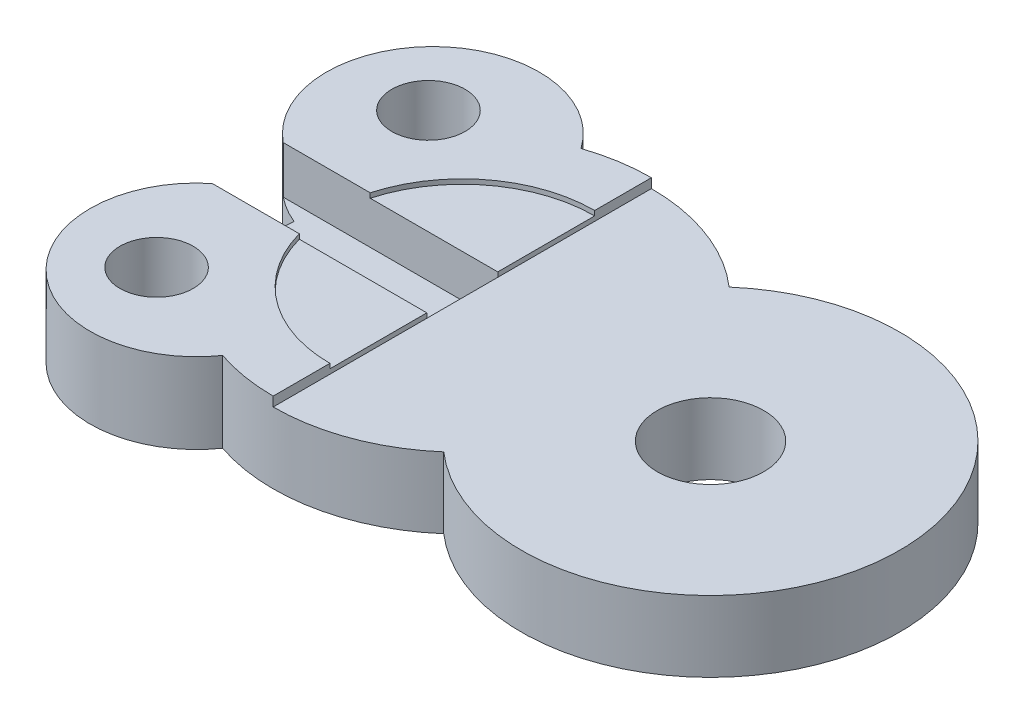
from build123d import *
from build123d.topology import SkipClean

# Parameters (mm, degrees)
SKETCH_1_R          = 2.25
EXTRUDE_1_DEPTH     = 3
EXTRUDE_2_DEPTH     = 0.4
SKETCH_6_W          = 12.522512513
SKETCH_6_H          = 3
CUT_EXTRUDE_1_DEPTH = 2
SKETCH_7_R          = 5.6
CUT_EXTRUDE_2_DEPTH = 0.2
SKETCH_9_R          = 1.55
CUT_EXTRUDE_3_DEPTH = 24.519352456


with BuildPart() as part:
    # 草图1 → 凸台-拉伸1 (new body)
    with BuildSketch(Plane(origin=(0, 0, 0), x_dir=(1, 0, 0), z_dir=(0, 1, 0))):
        with BuildLine():
            ThreePointArc((-5.25, -6.036348234), (8, 0), (-5.25, 6.036348234))
            ThreePointArc((-5.25, 6.036348234), (-8.948430916, 7.848097437), (-13.058047675, 7.579999479))
            ThreePointArc((-13.058047675, 7.579999479), (-20.257809372, 7.8125), (-18.455991924, 0.837969271))
            ThreePointArc((-18.455991924, 0.837969271), (-18.5, 0), (-18.455991924, -0.837969271))
            ThreePointArc((-18.455991924, -0.837969271), (-20.257809372, -7.8125), (-13.058047675, -7.579999479))
            ThreePointArc((-13.058047675, -7.579999479), (-8.948430916, -7.848097437), (-5.25, -6.036348234))
        make_face()
        with Locations(Location((0, 0, 0), (0, 0, 270))):
            Circle(SKETCH_1_R, mode=Mode.SUBTRACT)
    extrude(amount=EXTRUDE_1_DEPTH)

    # 草图5 → 凸台-拉伸2 (add)
    with SkipClean():  # the faces are left unmerged after this step: merging them gives an invalid solid
        with BuildSketch(Plane(origin=(0, 3, 0), x_dir=(1, 0, 0), z_dir=(0, 1, 0))):
            with BuildLine():
                Line((-10.5, 8), (-10.5, -8))
                ThreePointArc((-10.5, -8), (-11.796148944, -7.89430161), (-13.058047675, -7.579999479))
                ThreePointArc((-13.058047675, -7.579999479), (-20.257809372, -7.8125), (-18.455991924, -0.837969271))
                ThreePointArc((-18.455991924, -0.837969271), (-18.5, 0), (-18.455991924, 0.837969271))
                ThreePointArc((-18.455991924, 0.837969271), (-20.257809372, 7.8125), (-13.058047675, 7.579999479))
                ThreePointArc((-13.058047675, 7.579999479), (-11.796148944, 7.89430161), (-10.5, 8))
            make_face()
        extrude(amount=EXTRUDE_2_DEPTH)

    # 草图6 → 切除-拉伸1 (cut)
    with SkipClean():  # the faces are left unmerged after this step: merging them gives an invalid solid
        with BuildSketch(Plane(origin=(0, 3.4, 0), x_dir=(1, 0, 0), z_dir=(0, 1, 0))):
            with Locations((-16.761256257, 0)):
                Rectangle(SKETCH_6_W, SKETCH_6_H)
        extrude(amount=-CUT_EXTRUDE_1_DEPTH, mode=Mode.SUBTRACT)

    # 草图7 → 切除-拉伸2 (cut)
    with SkipClean():  # the faces are left unmerged after this step: merging them gives an invalid solid
        with BuildSketch(Plane(origin=(0, 3.4, 0), x_dir=(1, 0, 0), z_dir=(0, 1, 0))):
            with Locations((-10.5, 0)):
                Circle(SKETCH_7_R)
        extrude(amount=-CUT_EXTRUDE_2_DEPTH, mode=Mode.SUBTRACT)

    # 草图9 → 切除-拉伸3 (cut, through all)
    with SkipClean():  # the faces are left unmerged after this step: merging them gives an invalid solid
        with BuildSketch(Plane(origin=(0, 3.4, 0), x_dir=(1, 0, 0), z_dir=(0, 1, 0))):
            with Locations(Location((-17.681747698, 5.75, 0), (0, 0, 270))):
                Circle(SKETCH_9_R)
            with Locations(Location((-17.681747698, -5.75, 0), (0, 0, 270))):
                Circle(SKETCH_9_R)
        extrude(amount=-CUT_EXTRUDE_3_DEPTH, mode=Mode.SUBTRACT)


solid = part.part
